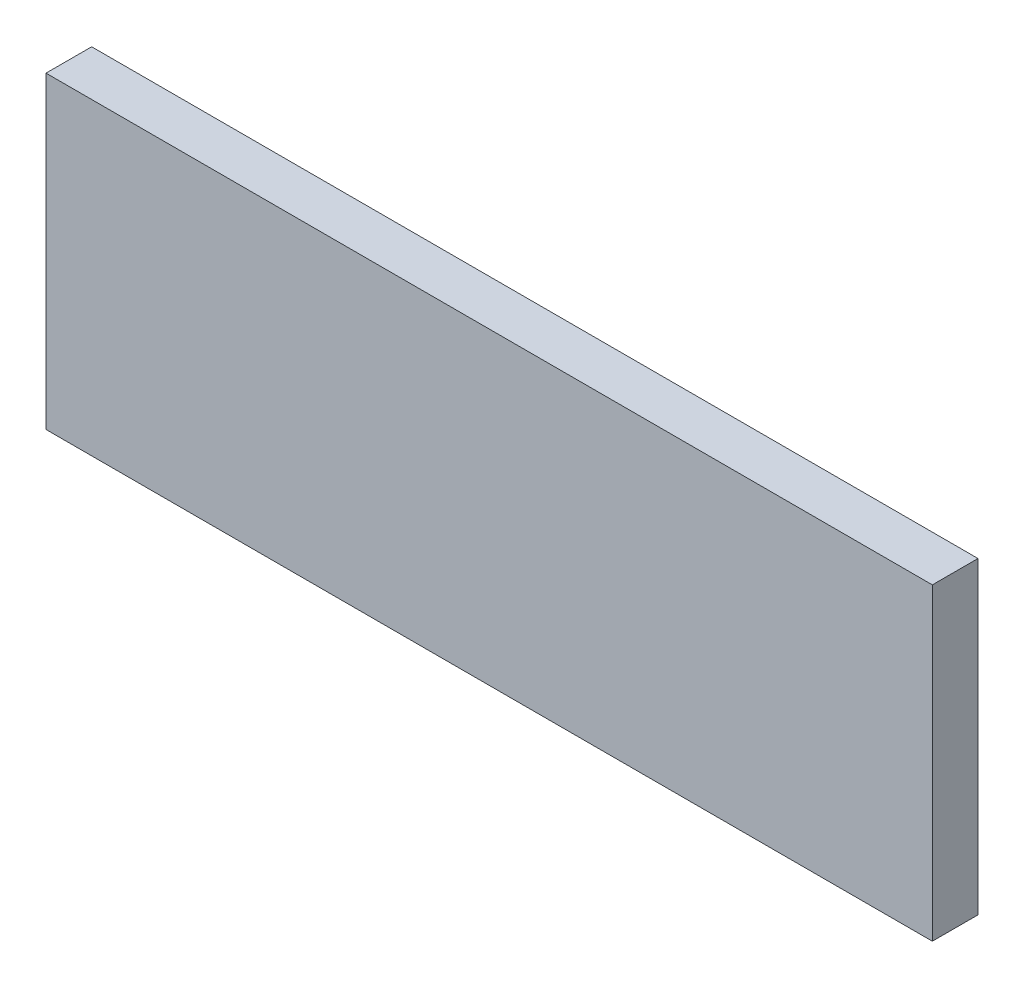
from build123d import *

# Parameters (mm, degrees)
SKETCH2_W           = 92.456
SKETCH2_H           = 32.1945
BOSS_EXTRUDE1_DEPTH = 4.7625


with BuildPart() as part:
    # Sketch2 → Boss-Extrude1 (new body)
    with BuildSketch(Plane.XY):
        Rectangle(SKETCH2_W, SKETCH2_H)
    extrude(amount=BOSS_EXTRUDE1_DEPTH)


solid = part.part
